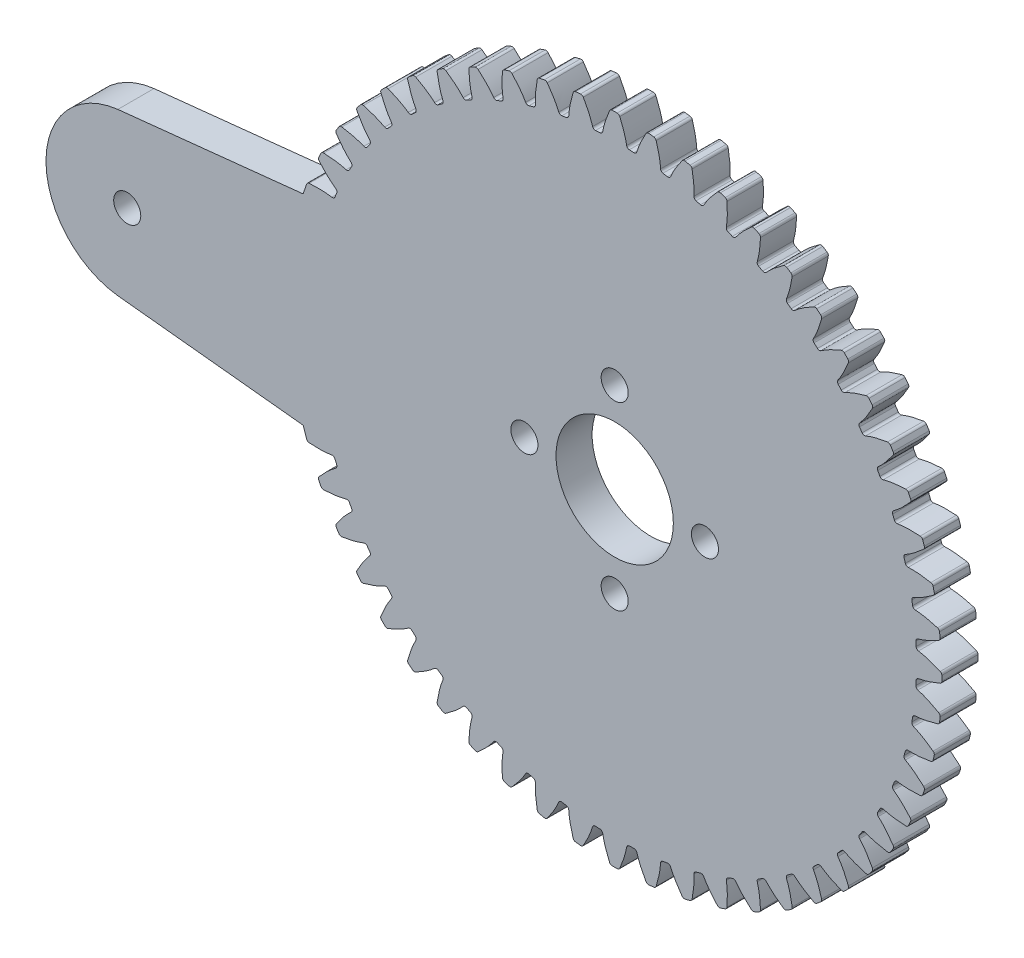
from build123d import *

# Parameters (mm, degrees)
SKETCH_1_R          = 0.925
SKETCH_1_R_2        = 6.5
SKETCH_1_R_3        = 1.5
EXTRUDE_1_DEPTH     = 4
SKETCH_2_R          = 1.5
CUT_EXTRUDE_1_DEPTH = 73.79417917


with BuildPart() as part:
    # 草图1 → 凸台-拉伸1 (new body)
    with BuildSketch(Plane.XY):
        with BuildLine():
            Line((-34.50942405, 11.097844463), (-55.040148969, 8.939691836))
            ThreePointArc((-55.040148969, 8.939691836), (-60.688303502, 6.022175376), (-62.999444444, 0.099998457))
            Line((-62.999444444, 0.099998457), (-62.999444444, -0.099998457))
            ThreePointArc((-62.999444444, -0.099998457), (-60.688303429, -6.022175457), (-55.040148753, -8.939691861))
            Line((-55.040148753, -8.939691861), (-34.50942405, -11.097844464))
            ThreePointArc((-34.50942405, -11.097844464), (-34.320285102, -11.669641406), (-34.121672605, -12.238217135))
            ThreePointArc((-34.121672605, -12.238217135), (-34.014786782, -12.382890198), (-33.845856953, -12.444676824))
            add(Edge.make_bspline(
                [(-33.845856953, -12.444676824), (-33.491111813, -12.465528285), (-32.807050741, -12.49985801), (-31.964846502, -12.456104517), (-31.482465707, -12.393674502), (-31.327681969, -12.36898156)],
                knots=[0.205793923, 0.205793923, 0.205793923, 0.205793923, 1.271237168, 2.259978144, 2.730069625, 2.730069625, 2.730069625, 2.730069625], degree=3))
            ThreePointArc((-31.327681969, -12.36898156), (-31.124871156, -12.405422055), (-30.988835509, -12.560194268))
            ThreePointArc((-30.988835509, -12.560194268), (-30.940753286, -12.678177799), (-30.892221868, -12.79597727))
            ThreePointArc((-30.892221868, -12.79597727), (-30.843241959, -12.913590969), (-30.79381427, -13.031017189))
            ThreePointArc((-30.79381427, -13.031017189), (-30.780565517, -13.2366494), (-30.898207097, -13.405825622))
            add(Edge.make_bspline(
                [(-32.732350338, -15.132919594), (-32.496251854, -14.867332691), (-32.036822413, -14.359353687), (-31.410355692, -13.79476375), (-31.025116275, -13.497813706), (-30.898207097, -13.405825622)],
                knots=[0.205793923, 0.205793923, 0.205793923, 0.205793923, 1.271237168, 2.259978144, 2.730069625, 2.730069625, 2.730069625, 2.730069625], degree=3))
            ThreePointArc((-32.732350338, -15.132919594), (-32.808112023, -15.296060764), (-32.78139241, -15.473939759))
            ThreePointArc((-32.78139241, -15.473939759), (-32.660121461, -15.728285543), (-32.53687712, -15.981680991))
            ThreePointArc((-32.53687712, -15.981680991), (-32.414465128, -16.113476965), (-32.239679587, -16.15596095))
            add(Edge.make_bspline(
                [(-32.239679587, -16.15596095), (-31.884830388, -16.136962448), (-31.201226839, -16.094485775), (-30.36921704, -15.956710438), (-29.896859298, -15.840663458), (-29.74581354, -15.798795499)],
                knots=[0.205793923, 0.205793923, 0.205793923, 0.205793923, 1.271237168, 2.259978144, 2.730069625, 2.730069625, 2.730069625, 2.730069625], degree=3))
            ThreePointArc((-29.74581354, -15.798795499), (-29.540197918, -15.812299258), (-29.387688644, -15.950867136))
            ThreePointArc((-29.387688644, -15.950867136), (-29.326698789, -16.06272531), (-29.26528317, -16.174350288))
            ThreePointArc((-29.26528317, -16.174350288), (-29.20344268, -16.285740446), (-29.141178216, -16.39689417))
            ThreePointArc((-29.141178216, -16.39689417), (-29.104989266, -16.599750019), (-29.202949413, -16.781034174))
            add(Edge.make_bspline(
                [(-30.832186775, -18.702627429), (-30.627309127, -18.412275838), (-30.227644085, -17.856051122), (-29.668330472, -17.224869191), (-29.318761215, -16.886653176), (-29.202949413, -16.781034174)],
                knots=[0.205793923, 0.205793923, 0.205793923, 0.205793923, 1.271237168, 2.259978144, 2.730069625, 2.730069625, 2.730069625, 2.730069625], degree=3))
            ThreePointArc((-30.832186775, -18.702627429), (-30.889206071, -18.87322542), (-30.842738337, -19.046994301))
            ThreePointArc((-30.842738337, -19.046994301), (-30.693752222, -19.286162774), (-30.542911526, -19.524165936))
            ThreePointArc((-30.542911526, -19.524165936), (-30.406512768, -19.64142741), (-30.228069545, -19.664074493))
            add(Edge.make_bspline(
                [(-30.228069545, -19.664074493), (-29.877578721, -19.605464945), (-29.203029405, -19.486716044), (-28.391677053, -19.256651468), (-27.935282537, -19.088446879), (-27.789874247, -19.029930418)],
                knots=[0.205793923, 0.205793923, 0.205793923, 0.205793923, 1.271237168, 2.259978144, 2.730069625, 2.730069625, 2.730069625, 2.730069625], degree=3))
            ThreePointArc((-27.789874247, -19.029930418), (-27.584039552, -19.020327623), (-27.416974544, -19.140948594))
            ThreePointArc((-27.416974544, -19.140948594), (-27.343844038, -19.245274731), (-27.270316556, -19.349321466))
            ThreePointArc((-27.270316556, -19.349321466), (-27.196393165, -19.453087289), (-27.122074938, -19.556570693))
            ThreePointArc((-27.122074938, -19.556570693), (-27.063400888, -19.75409915), (-27.140447697, -19.945211485))
            add(Edge.make_bspline(
                [(-28.544290574, -22.037138873), (-28.373210218, -21.725673933), (-28.038335594, -21.128198354), (-27.553208783, -20.438361907), (-27.243705723, -20.063133184), (-27.140447697, -19.945211485)],
                knots=[0.205793923, 0.205793923, 0.205793923, 0.205793923, 1.271237168, 2.259978144, 2.730069625, 2.730069625, 2.730069625, 2.730069625], degree=3))
            ThreePointArc((-28.544290574, -22.037138873), (-28.58185043, -22.213048314), (-28.516218934, -22.380521838))
            ThreePointArc((-28.516218934, -22.380521838), (-28.341391239, -22.601505317), (-28.164851099, -22.821123166))
            ThreePointArc((-28.164851099, -22.821123166), (-28.016180868, -22.922375509), (-27.83632399, -22.92490089))
            add(Edge.make_bspline(
                [(-27.83632399, -22.92490089), (-27.494599165, -22.827417345), (-26.837586933, -22.633889551), (-26.057095254, -22.314428932), (-25.622403389, -22.096182006), (-25.484461161, -22.021752921)],
                knots=[0.205793923, 0.205793923, 0.205793923, 0.205793923, 1.271237168, 2.259978144, 2.730069625, 2.730069625, 2.730069625, 2.730069625], degree=3))
            ThreePointArc((-25.484461161, -22.021752921), (-25.280995883, -21.989164332), (-25.101476081, -22.090321518))
            ThreePointArc((-25.101476081, -22.090321518), (-25.017124583, -22.185803655), (-24.932409888, -22.2809637))
            ThreePointArc((-24.932409888, -22.2809637), (-24.847333226, -22.375800272), (-24.761895832, -22.470311993))
            ThreePointArc((-24.761895832, -22.470311993), (-24.681474542, -22.660029023), (-24.736639104, -22.858566189))
            add(Edge.make_bspline(
                [(-25.897433358, -25.094520509), (-25.762301727, -24.765859073), (-25.496428765, -24.134646233), (-25.091589506, -23.394830363), (-24.826044823, -22.987307652), (-24.736639104, -22.858566189)],
                knots=[0.205793923, 0.205793923, 0.205793923, 0.205793923, 1.271237168, 2.259978144, 2.730069625, 2.730069625, 2.730069625, 2.730069625], degree=3))
            ThreePointArc((-25.897433358, -25.094520509), (-25.915061437, -25.273529238), (-25.831091532, -25.432601327))
            ThreePointArc((-25.831091532, -25.432601327), (-25.632620818, -25.632620818), (-25.432601327, -25.831091532))
            ThreePointArc((-25.432601327, -25.831091532), (-25.273529238, -25.915061437), (-25.094520509, -25.897433358))
            add(Edge.make_bspline(
                [(-25.094520509, -25.897433358), (-24.765859073, -25.762301727), (-24.134646233, -25.496428765), (-23.394830363, -25.091589506), (-22.987307652, -24.826044823), (-22.858566189, -24.736639104)],
                knots=[0.205793923, 0.205793923, 0.205793923, 0.205793923, 1.271237168, 2.259978144, 2.730069625, 2.730069625, 2.730069625, 2.730069625], degree=3))
            ThreePointArc((-22.858566189, -24.736639104), (-22.660029023, -24.681474542), (-22.470311993, -24.761895832))
            ThreePointArc((-22.470311993, -24.761895832), (-22.375800272, -24.847333226), (-22.2809637, -24.932409888))
            ThreePointArc((-22.2809637, -24.932409888), (-22.185803655, -25.017124583), (-22.090321518, -25.101476081))
            ThreePointArc((-22.090321518, -25.101476081), (-21.989164332, -25.280995883), (-22.021752921, -25.484461161))
            add(Edge.make_bspline(
                [(-22.92490089, -27.83632399), (-22.827417345, -27.494599165), (-22.633889551, -26.837586933), (-22.314428932, -26.057095254), (-22.096182006, -25.622403389), (-22.021752921, -25.484461161)],
                knots=[0.205793923, 0.205793923, 0.205793923, 0.205793923, 1.271237168, 2.259978144, 2.730069625, 2.730069625, 2.730069625, 2.730069625], degree=3))
            ThreePointArc((-22.92490089, -27.83632399), (-22.922375509, -28.016180868), (-22.821123166, -28.164851099))
            ThreePointArc((-22.821123166, -28.164851099), (-22.601505317, -28.341391239), (-22.380521838, -28.516218933))
            ThreePointArc((-22.380521838, -28.516218933), (-22.213048314, -28.58185043), (-22.037138873, -28.544290574))
            add(Edge.make_bspline(
                [(-22.037138873, -28.544290574), (-21.725673933, -28.373210218), (-21.128198354, -28.038335594), (-20.438361907, -27.553208783), (-20.063133184, -27.243705722), (-19.945211485, -27.140447697)],
                knots=[0.205793923, 0.205793923, 0.205793923, 0.205793923, 1.271237168, 2.259978144, 2.730069625, 2.730069625, 2.730069625, 2.730069625], degree=3))
            ThreePointArc((-19.945211485, -27.140447697), (-19.75409915, -27.063400888), (-19.556570693, -27.122074938))
            ThreePointArc((-19.556570693, -27.122074938), (-19.453087289, -27.196393165), (-19.349321466, -27.270316556))
            ThreePointArc((-19.349321466, -27.270316556), (-19.245274731, -27.343844038), (-19.140948594, -27.416974544))
            ThreePointArc((-19.140948594, -27.416974544), (-19.020327623, -27.584039551), (-19.029930418, -27.789874247))
            add(Edge.make_bspline(
                [(-19.664074493, -30.228069545), (-19.605464945, -29.87757872), (-19.486716044, -29.203029405), (-19.256651468, -28.391677053), (-19.088446879, -27.935282537), (-19.029930418, -27.789874247)],
                knots=[0.205793923, 0.205793923, 0.205793923, 0.205793923, 1.271237168, 2.259978144, 2.730069625, 2.730069625, 2.730069625, 2.730069625], degree=3))
            ThreePointArc((-19.664074493, -30.228069545), (-19.64142741, -30.406512768), (-19.524165936, -30.542911526))
            ThreePointArc((-19.524165936, -30.542911526), (-19.286162774, -30.693752222), (-19.0469943, -30.842738337))
            ThreePointArc((-19.0469943, -30.842738337), (-18.873225419, -30.889206071), (-18.702627429, -30.832186775))
            add(Edge.make_bspline(
                [(-18.702627429, -30.832186775), (-18.412275838, -30.627309127), (-17.856051122, -30.227644085), (-17.22486919, -29.668330472), (-16.886653176, -29.318761215), (-16.781034174, -29.202949413)],
                knots=[0.205793923, 0.205793923, 0.205793923, 0.205793923, 1.271237168, 2.259978144, 2.730069625, 2.730069625, 2.730069625, 2.730069625], degree=3))
            ThreePointArc((-16.781034174, -29.202949413), (-16.599750019, -29.104989266), (-16.39689417, -29.141178216))
            ThreePointArc((-16.39689417, -29.141178216), (-16.285740446, -29.20344268), (-16.174350287, -29.26528317))
            ThreePointArc((-16.174350287, -29.26528317), (-16.06272531, -29.326698789), (-15.950867136, -29.387688644))
            ThreePointArc((-15.950867136, -29.387688644), (-15.812299258, -29.540197918), (-15.798795499, -29.74581354))
            add(Edge.make_bspline(
                [(-16.15596095, -32.239679587), (-16.136962448, -31.884830388), (-16.094485775, -31.201226838), (-15.956710438, -30.36921704), (-15.840663458, -29.896859298), (-15.798795499, -29.74581354)],
                knots=[0.205793923, 0.205793923, 0.205793923, 0.205793923, 1.271237168, 2.259978144, 2.730069625, 2.730069625, 2.730069625, 2.730069625], degree=3))
            ThreePointArc((-16.15596095, -32.239679587), (-16.113476965, -32.414465128), (-15.981680991, -32.536877119))
            ThreePointArc((-15.981680991, -32.536877119), (-15.728285543, -32.660121461), (-15.473939759, -32.78139241))
            ThreePointArc((-15.473939759, -32.78139241), (-15.296060764, -32.808112023), (-15.132919594, -32.732350338))
            add(Edge.make_bspline(
                [(-15.132919594, -32.732350338), (-14.867332691, -32.496251854), (-14.359353687, -32.036822412), (-13.79476375, -31.410355692), (-13.497813705, -31.025116274), (-13.405825622, -30.898207096)],
                knots=[0.205793923, 0.205793923, 0.205793923, 0.205793923, 1.271237168, 2.259978144, 2.730069625, 2.730069625, 2.730069625, 2.730069625], degree=3))
            ThreePointArc((-13.405825622, -30.898207096), (-13.236649399, -30.780565517), (-13.031017189, -30.793814269))
            ThreePointArc((-13.031017189, -30.793814269), (-12.913590969, -30.843241959), (-12.79597727, -30.892221868))
            ThreePointArc((-12.79597727, -30.892221868), (-12.678177799, -30.940753286), (-12.560194268, -30.988835509))
            ThreePointArc((-12.560194268, -30.988835509), (-12.405422055, -31.124871156), (-12.36898156, -31.327681969))
            add(Edge.make_bspline(
                [(-12.444676824, -33.845856952), (-12.465528285, -33.491111813), (-12.49985801, -32.807050741), (-12.456104517, -31.964846502), (-12.393674502, -31.482465707), (-12.36898156, -31.327681969)],
                knots=[0.205793923, 0.205793923, 0.205793923, 0.205793923, 1.271237168, 2.259978144, 2.730069625, 2.730069625, 2.730069625, 2.730069625], degree=3))
            ThreePointArc((-12.444676824, -33.845856952), (-12.382890198, -34.014786781), (-12.238217135, -34.121672605))
            ThreePointArc((-12.238217135, -34.121672605), (-11.972615996, -34.215770723), (-11.706291446, -34.307801453))
            ThreePointArc((-11.706291446, -34.307801453), (-11.52653927, -34.314436931), (-11.372906515, -34.220885603))
            add(Edge.make_bspline(
                [(-11.372906515, -34.220885603), (-11.13542421, -33.956535359), (-10.682079047, -33.44311911), (-10.191181152, -32.757377465), (-9.939231396, -32.341312495), (-9.862031034, -32.204901898)],
                knots=[0.205793923, 0.205793923, 0.205793923, 0.205793923, 1.271237168, 2.259978144, 2.730069625, 2.730069625, 2.730069625, 2.730069625], degree=3))
            ThreePointArc((-9.862031034, -32.204901898), (-9.707090234, -32.069058297), (-9.501267606, -32.059200241))
            ThreePointArc((-9.501267606, -32.059200241), (-9.379045592, -32.095169574), (-9.256687413, -32.130672952))
            ThreePointArc((-9.256687413, -32.130672952), (-9.134194847, -32.165709859), (-9.01156967, -32.200279786))
            ThreePointArc((-9.01156967, -32.200279786), (-8.842539472, -32.31813108), (-8.783620501, -32.51558662))
            add(Edge.make_bspline(
                [(-8.576893666, -35.026403029), (-8.637332871, -34.676223075), (-8.748037278, -34.000306945), (-8.798855854, -33.158499473), (-8.790827899, -32.672161843), (-8.783620501, -32.51558662)],
                knots=[0.205793923, 0.205793923, 0.205793923, 0.205793923, 1.271237168, 2.259978144, 2.730069625, 2.730069625, 2.730069625, 2.730069625], degree=3))
            ThreePointArc((-8.576893666, -35.026403029), (-8.496581401, -35.187352755), (-8.340850597, -35.277368259))
            ThreePointArc((-8.340850597, -35.277368259), (-8.066383856, -35.341136816), (-7.791429727, -35.402769987))
            ThreePointArc((-7.791429727, -35.402769987), (-7.612064857, -35.389237884), (-7.469872537, -35.279073377))
            add(Edge.make_bspline(
                [(-7.469872537, -35.279073377), (-7.263481308, -34.989795729), (-6.870471066, -34.428849181), (-6.459438537, -33.692456209), (-6.255657485, -33.250797947), (-6.194215684, -33.106601372)],
                knots=[0.205793923, 0.205793923, 0.205793923, 0.205793923, 1.271237168, 2.259978144, 2.730069625, 2.730069625, 2.730069625, 2.730069625], degree=3))
            ThreePointArc((-6.194215684, -33.106601372), (-6.055458777, -32.954264062), (-5.85203407, -32.921423169))
            ThreePointArc((-5.85203407, -32.921423169), (-5.726553275, -32.943481811), (-5.600989342, -32.965062181))
            ThreePointArc((-5.600989342, -32.965062181), (-5.475344094, -32.986163967), (-5.349619355, -33.006786862))
            ThreePointArc((-5.349619355, -33.006786862), (-5.168456825, -33.104971755), (-5.087800318, -33.294588904))
            add(Edge.make_bspline(
                [(-4.601251094, -35.766471764), (-4.700517985, -35.425260713), (-4.886204901, -34.765989562), (-5.030956473, -33.935165074), (-5.077431534, -33.450986587), (-5.087800318, -33.294588904)],
                knots=[0.205793923, 0.205793923, 0.205793923, 0.205793923, 1.271237168, 2.259978144, 2.730069625, 2.730069625, 2.730069625, 2.730069625], degree=3))
            ThreePointArc((-4.601251094, -35.766471764), (-4.503423164, -35.917417352), (-4.338593024, -35.989430539))
            ThreePointArc((-4.338593024, -35.989430539), (-4.058712259, -36.022067608), (-3.778586258, -36.052528148))
            ThreePointArc((-3.778586258, -36.052528148), (-3.601864311, -36.018998638), (-3.472900579, -35.893606334))
            add(Edge.make_bspline(
                [(-3.472900579, -35.893606334), (-3.300195914, -35.583039117), (-2.972462924, -34.981616497), (-2.646464736, -34.203832768), (-2.493415052, -33.742135321), (-2.448504477, -33.591966126)],
                knots=[0.205793923, 0.205793923, 0.205793923, 0.205793923, 1.271237168, 2.259978144, 2.730069625, 2.730069625, 2.730069625, 2.730069625], degree=3))
            ThreePointArc((-2.448504477, -33.591966126), (-2.327676412, -33.425050836), (-2.129207811, -33.369640099))
            ThreePointArc((-2.129207811, -33.369640099), (-2.002046228, -33.377510649), (-1.874855579, -33.384896627))
            ThreePointArc((-1.874855579, -33.384896627), (-1.747637712, -33.391797925), (-1.620394472, -33.398214443))
            ThreePointArc((-1.620394472, -33.398214443), (-1.429377834, -33.475498202), (-1.327998093, -33.654892414))
            add(Edge.make_bspline(
                [(-0.56774512, -36.056756365), (-0.704591358, -35.728805142), (-0.962925663, -35.094469689), (-1.199789896, -34.285076284), (-1.300183522, -33.809145767), (-1.327998093, -33.654892414)],
                knots=[0.205793923, 0.205793923, 0.205793923, 0.205793923, 1.271237168, 2.259978144, 2.730069625, 2.730069625, 2.730069625, 2.730069625], degree=3))
            ThreePointArc((-0.56774512, -36.056756365), (-0.453631768, -36.195799586), (-0.281775126, -36.248904849))
            ThreePointArc((-0.281775126, -36.248904849), (0, -36.25), (0.281775126, -36.248904849))
            ThreePointArc((0.281775126, -36.248904849), (0.453631768, -36.195799586), (0.56774512, -36.056756365))
            add(Edge.make_bspline(
                [(0.56774512, -36.056756365), (0.704591358, -35.728805142), (0.962925663, -35.094469689), (1.199789896, -34.285076284), (1.300183522, -33.809145766), (1.327998093, -33.654892414)],
                knots=[0.205793923, 0.205793923, 0.205793923, 0.205793923, 1.271237168, 2.259978144, 2.730069625, 2.730069625, 2.730069625, 2.730069625], degree=3))
            ThreePointArc((1.327998093, -33.654892414), (1.429377834, -33.475498202), (1.620394472, -33.398214443))
            ThreePointArc((1.620394472, -33.398214443), (1.747637712, -33.391797925), (1.874855579, -33.384896627))
            ThreePointArc((1.874855579, -33.384896627), (2.002046228, -33.377510649), (2.129207811, -33.369640099))
            ThreePointArc((2.129207811, -33.369640099), (2.327676412, -33.425050836), (2.448504477, -33.591966126))
            add(Edge.make_bspline(
                [(3.472900579, -35.893606334), (3.300195914, -35.583039118), (2.972462925, -34.981616497), (2.646464736, -34.203832768), (2.493415052, -33.742135322), (2.448504477, -33.591966126)],
                knots=[0.205793923, 0.205793923, 0.205793923, 0.205793923, 1.271237168, 2.259978144, 2.730069625, 2.730069625, 2.730069625, 2.730069625], degree=3))
            ThreePointArc((3.472900579, -35.893606334), (3.601864311, -36.018998639), (3.778586258, -36.052528148))
            ThreePointArc((3.778586258, -36.052528148), (4.058712259, -36.022067609), (4.338593024, -35.98943054))
            ThreePointArc((4.338593024, -35.98943054), (4.503423164, -35.917417352), (4.601251094, -35.766471764))
            add(Edge.make_bspline(
                [(4.601251094, -35.766471764), (4.700517985, -35.425260713), (4.886204901, -34.765989563), (5.030956473, -33.935165074), (5.077431535, -33.450986588), (5.087800318, -33.294588904)],
                knots=[0.205793923, 0.205793923, 0.205793923, 0.205793923, 1.271237168, 2.259978144, 2.730069625, 2.730069625, 2.730069625, 2.730069625], degree=3))
            ThreePointArc((5.087800318, -33.294588904), (5.168456825, -33.104971755), (5.349619355, -33.006786863))
            ThreePointArc((5.349619355, -33.006786863), (5.475344094, -32.986163968), (5.600989342, -32.965062182))
            ThreePointArc((5.600989342, -32.965062182), (5.726553275, -32.943481811), (5.852034071, -32.921423169))
            ThreePointArc((5.852034071, -32.921423169), (6.055458777, -32.954264062), (6.194215684, -33.106601373))
            add(Edge.make_bspline(
                [(7.469872538, -35.279073377), (7.263481308, -34.98979573), (6.870471066, -34.428849181), (6.459438538, -33.692456209), (6.255657485, -33.250797947), (6.194215684, -33.106601373)],
                knots=[0.205793923, 0.205793923, 0.205793923, 0.205793923, 1.271237168, 2.259978144, 2.730069625, 2.730069625, 2.730069625, 2.730069625], degree=3))
            ThreePointArc((7.469872538, -35.279073377), (7.612064857, -35.389237885), (7.791429727, -35.402769988))
            ThreePointArc((7.791429727, -35.402769988), (8.066383856, -35.341136817), (8.340850597, -35.277368259))
            ThreePointArc((8.340850597, -35.277368259), (8.496581401, -35.187352755), (8.576893666, -35.026403029))
            add(Edge.make_bspline(
                [(8.576893666, -35.026403029), (8.637332871, -34.676223076), (8.748037278, -34.000306946), (8.798855854, -33.158499473), (8.790827899, -32.672161843), (8.783620501, -32.515586621)],
                knots=[0.205793923, 0.205793923, 0.205793923, 0.205793923, 1.271237168, 2.259978144, 2.730069625, 2.730069625, 2.730069625, 2.730069625], degree=3))
            ThreePointArc((8.783620501, -32.515586621), (8.842539472, -32.318131081), (9.01156967, -32.200279786))
            ThreePointArc((9.01156967, -32.200279786), (9.134194847, -32.165709859), (9.256687413, -32.130672953))
            ThreePointArc((9.256687413, -32.130672953), (9.379045592, -32.095169575), (9.501267606, -32.059200241))
            ThreePointArc((9.501267606, -32.059200241), (9.707090234, -32.069058297), (9.862031034, -32.204901898))
            add(Edge.make_bspline(
                [(11.372906515, -34.220885604), (11.13542421, -33.956535359), (10.682079047, -33.44311911), (10.191181152, -32.757377465), (9.939231396, -32.341312495), (9.862031034, -32.204901898)],
                knots=[0.205793923, 0.205793923, 0.205793923, 0.205793923, 1.271237168, 2.259978144, 2.730069625, 2.730069625, 2.730069625, 2.730069625], degree=3))
            ThreePointArc((11.372906515, -34.220885604), (11.52653927, -34.314436931), (11.706291446, -34.307801454))
            ThreePointArc((11.706291446, -34.307801454), (11.972615996, -34.215770724), (12.238217135, -34.121672605))
            ThreePointArc((12.238217135, -34.121672605), (12.382890198, -34.014786782), (12.444676824, -33.845856953))
            add(Edge.make_bspline(
                [(12.444676824, -33.845856953), (12.465528285, -33.491111813), (12.49985801, -32.807050741), (12.456104517, -31.964846502), (12.393674502, -31.482465707), (12.36898156, -31.327681969)],
                knots=[0.205793923, 0.205793923, 0.205793923, 0.205793923, 1.271237168, 2.259978144, 2.730069625, 2.730069625, 2.730069625, 2.730069625], degree=3))
            ThreePointArc((12.36898156, -31.327681969), (12.405422055, -31.124871156), (12.560194268, -30.988835509))
            ThreePointArc((12.560194268, -30.988835509), (12.678177799, -30.940753286), (12.79597727, -30.892221868))
            ThreePointArc((12.79597727, -30.892221868), (12.913590969, -30.843241959), (13.031017189, -30.79381427))
            ThreePointArc((13.031017189, -30.79381427), (13.2366494, -30.780565517), (13.405825622, -30.898207097))
            add(Edge.make_bspline(
                [(15.132919594, -32.732350338), (14.867332691, -32.496251854), (14.359353687, -32.036822413), (13.79476375, -31.410355692), (13.497813706, -31.025116275), (13.405825622, -30.898207097)],
                knots=[0.205793923, 0.205793923, 0.205793923, 0.205793923, 1.271237168, 2.259978144, 2.730069625, 2.730069625, 2.730069625, 2.730069625], degree=3))
            ThreePointArc((15.132919594, -32.732350338), (15.296060764, -32.808112023), (15.473939759, -32.78139241))
            ThreePointArc((15.473939759, -32.78139241), (15.728285543, -32.660121461), (15.981680991, -32.53687712))
            ThreePointArc((15.981680991, -32.53687712), (16.113476965, -32.414465128), (16.15596095, -32.239679587))
            add(Edge.make_bspline(
                [(16.15596095, -32.239679587), (16.136962448, -31.884830388), (16.094485775, -31.201226839), (15.956710439, -30.36921704), (15.840663458, -29.896859298), (15.798795499, -29.74581354)],
                knots=[0.205793923, 0.205793923, 0.205793923, 0.205793923, 1.271237168, 2.259978144, 2.730069625, 2.730069625, 2.730069625, 2.730069625], degree=3))
            ThreePointArc((15.798795499, -29.74581354), (15.812299258, -29.540197918), (15.950867136, -29.387688644))
            ThreePointArc((15.950867136, -29.387688644), (16.062725311, -29.326698789), (16.174350288, -29.26528317))
            ThreePointArc((16.174350288, -29.26528317), (16.285740447, -29.20344268), (16.39689417, -29.141178216))
            ThreePointArc((16.39689417, -29.141178216), (16.599750019, -29.104989266), (16.781034174, -29.202949413))
            add(Edge.make_bspline(
                [(18.702627429, -30.832186775), (18.412275838, -30.627309127), (17.856051122, -30.227644085), (17.224869191, -29.668330472), (16.886653176, -29.318761215), (16.781034174, -29.202949413)],
                knots=[0.205793923, 0.205793923, 0.205793923, 0.205793923, 1.271237168, 2.259978144, 2.730069625, 2.730069625, 2.730069625, 2.730069625], degree=3))
            ThreePointArc((18.702627429, -30.832186775), (18.87322542, -30.889206071), (19.046994301, -30.842738337))
            ThreePointArc((19.046994301, -30.842738337), (19.286162774, -30.693752222), (19.524165936, -30.542911526))
            ThreePointArc((19.524165936, -30.542911526), (19.64142741, -30.406512768), (19.664074493, -30.228069545))
            add(Edge.make_bspline(
                [(19.664074493, -30.228069545), (19.605464945, -29.877578721), (19.486716044, -29.203029405), (19.256651468, -28.391677053), (19.088446879, -27.935282537), (19.029930418, -27.789874247)],
                knots=[0.205793923, 0.205793923, 0.205793923, 0.205793923, 1.271237168, 2.259978144, 2.730069625, 2.730069625, 2.730069625, 2.730069625], degree=3))
            ThreePointArc((19.029930418, -27.789874247), (19.020327623, -27.584039552), (19.140948594, -27.416974544))
            ThreePointArc((19.140948594, -27.416974544), (19.245274731, -27.343844038), (19.349321466, -27.270316556))
            ThreePointArc((19.349321466, -27.270316556), (19.453087289, -27.196393165), (19.556570693, -27.122074939))
            ThreePointArc((19.556570693, -27.122074939), (19.75409915, -27.063400888), (19.945211485, -27.140447697))
            add(Edge.make_bspline(
                [(22.037138873, -28.544290574), (21.725673933, -28.373210218), (21.128198354, -28.038335594), (20.438361907, -27.553208783), (20.063133184, -27.243705723), (19.945211485, -27.140447697)],
                knots=[0.205793923, 0.205793923, 0.205793923, 0.205793923, 1.271237168, 2.259978144, 2.730069625, 2.730069625, 2.730069625, 2.730069625], degree=3))
            ThreePointArc((22.037138873, -28.544290574), (22.213048314, -28.58185043), (22.380521838, -28.516218934))
            ThreePointArc((22.380521838, -28.516218934), (22.601505317, -28.341391239), (22.821123167, -28.164851099))
            ThreePointArc((22.821123167, -28.164851099), (22.922375509, -28.016180868), (22.92490089, -27.83632399))
            add(Edge.make_bspline(
                [(22.92490089, -27.83632399), (22.827417345, -27.494599165), (22.633889551, -26.837586933), (22.314428932, -26.057095254), (22.096182006, -25.622403389), (22.021752921, -25.484461161)],
                knots=[0.205793923, 0.205793923, 0.205793923, 0.205793923, 1.271237168, 2.259978144, 2.730069625, 2.730069625, 2.730069625, 2.730069625], degree=3))
            ThreePointArc((22.021752921, -25.484461161), (21.989164332, -25.280995883), (22.090321518, -25.101476082))
            ThreePointArc((22.090321518, -25.101476082), (22.185803655, -25.017124583), (22.2809637, -24.932409888))
            ThreePointArc((22.2809637, -24.932409888), (22.375800272, -24.847333226), (22.470311993, -24.761895832))
            ThreePointArc((22.470311993, -24.761895832), (22.660029023, -24.681474542), (22.858566189, -24.736639104))
            add(Edge.make_bspline(
                [(25.094520509, -25.897433358), (24.765859073, -25.762301727), (24.134646233, -25.496428765), (23.394830363, -25.091589506), (22.987307652, -24.826044823), (22.858566189, -24.736639104)],
                knots=[0.205793923, 0.205793923, 0.205793923, 0.205793923, 1.271237168, 2.259978144, 2.730069625, 2.730069625, 2.730069625, 2.730069625], degree=3))
            ThreePointArc((25.094520509, -25.897433358), (25.273529239, -25.915061437), (25.432601327, -25.831091532))
            ThreePointArc((25.432601327, -25.831091532), (25.632620818, -25.632620818), (25.831091532, -25.432601327))
            ThreePointArc((25.831091532, -25.432601327), (25.915061437, -25.273529239), (25.897433358, -25.094520509))
            add(Edge.make_bspline(
                [(25.897433358, -25.094520509), (25.762301727, -24.765859073), (25.496428765, -24.134646234), (25.091589506, -23.394830363), (24.826044823, -22.987307652), (24.736639104, -22.858566189)],
                knots=[0.205793923, 0.205793923, 0.205793923, 0.205793923, 1.271237168, 2.259978144, 2.730069625, 2.730069625, 2.730069625, 2.730069625], degree=3))
            ThreePointArc((24.736639104, -22.858566189), (24.681474542, -22.660029023), (24.761895832, -22.470311993))
            ThreePointArc((24.761895832, -22.470311993), (24.847333226, -22.375800272), (24.932409888, -22.2809637))
            ThreePointArc((24.932409888, -22.2809637), (25.017124583, -22.185803655), (25.101476082, -22.090321518))
            ThreePointArc((25.101476082, -22.090321518), (25.280995883, -21.989164332), (25.484461161, -22.021752921))
            add(Edge.make_bspline(
                [(27.83632399, -22.92490089), (27.494599165, -22.827417345), (26.837586933, -22.633889551), (26.057095254, -22.314428932), (25.622403389, -22.096182006), (25.484461161, -22.021752921)],
                knots=[0.205793923, 0.205793923, 0.205793923, 0.205793923, 1.271237168, 2.259978144, 2.730069625, 2.730069625, 2.730069625, 2.730069625], degree=3))
            ThreePointArc((27.83632399, -22.92490089), (28.016180868, -22.922375509), (28.164851099, -22.821123167))
            ThreePointArc((28.164851099, -22.821123167), (28.341391239, -22.601505317), (28.516218934, -22.380521838))
            ThreePointArc((28.516218934, -22.380521838), (28.58185043, -22.213048314), (28.544290574, -22.037138873))
            add(Edge.make_bspline(
                [(28.544290574, -22.037138873), (28.373210218, -21.725673933), (28.038335594, -21.128198354), (27.553208783, -20.438361907), (27.243705723, -20.063133184), (27.140447697, -19.945211485)],
                knots=[0.205793923, 0.205793923, 0.205793923, 0.205793923, 1.271237168, 2.259978144, 2.730069625, 2.730069625, 2.730069625, 2.730069625], degree=3))
            ThreePointArc((27.140447697, -19.945211485), (27.063400888, -19.75409915), (27.122074939, -19.556570693))
            ThreePointArc((27.122074939, -19.556570693), (27.196393165, -19.453087289), (27.270316556, -19.349321466))
            ThreePointArc((27.270316556, -19.349321466), (27.343844038, -19.245274731), (27.416974544, -19.140948594))
            ThreePointArc((27.416974544, -19.140948594), (27.584039552, -19.020327623), (27.789874247, -19.029930418))
            add(Edge.make_bspline(
                [(30.228069545, -19.664074493), (29.877578721, -19.605464945), (29.203029405, -19.486716044), (28.391677053, -19.256651468), (27.935282537, -19.088446879), (27.789874247, -19.029930418)],
                knots=[0.205793923, 0.205793923, 0.205793923, 0.205793923, 1.271237168, 2.259978144, 2.730069625, 2.730069625, 2.730069625, 2.730069625], degree=3))
            ThreePointArc((30.228069545, -19.664074493), (30.406512768, -19.64142741), (30.542911526, -19.524165936))
            ThreePointArc((30.542911526, -19.524165936), (30.693752222, -19.286162774), (30.842738337, -19.046994301))
            ThreePointArc((30.842738337, -19.046994301), (30.889206071, -18.87322542), (30.832186775, -18.702627429))
            add(Edge.make_bspline(
                [(30.832186775, -18.702627429), (30.627309127, -18.412275838), (30.227644085, -17.856051122), (29.668330472, -17.224869191), (29.318761215, -16.886653176), (29.202949413, -16.781034174)],
                knots=[0.205793923, 0.205793923, 0.205793923, 0.205793923, 1.271237168, 2.259978144, 2.730069625, 2.730069625, 2.730069625, 2.730069625], degree=3))
            ThreePointArc((29.202949413, -16.781034174), (29.104989266, -16.599750019), (29.141178216, -16.39689417))
            ThreePointArc((29.141178216, -16.39689417), (29.20344268, -16.285740447), (29.26528317, -16.174350288))
            ThreePointArc((29.26528317, -16.174350288), (29.326698789, -16.062725311), (29.387688644, -15.950867136))
            ThreePointArc((29.387688644, -15.950867136), (29.540197918, -15.812299258), (29.74581354, -15.798795499))
            add(Edge.make_bspline(
                [(32.239679587, -16.15596095), (31.884830388, -16.136962448), (31.201226839, -16.094485775), (30.36921704, -15.956710438), (29.896859298, -15.840663458), (29.74581354, -15.798795499)],
                knots=[0.205793923, 0.205793923, 0.205793923, 0.205793923, 1.271237168, 2.259978144, 2.730069625, 2.730069625, 2.730069625, 2.730069625], degree=3))
            ThreePointArc((32.239679587, -16.15596095), (32.414465128, -16.113476965), (32.53687712, -15.981680991))
            ThreePointArc((32.53687712, -15.981680991), (32.660121461, -15.728285543), (32.78139241, -15.473939759))
            ThreePointArc((32.78139241, -15.473939759), (32.808112023, -15.296060764), (32.732350338, -15.132919594))
            add(Edge.make_bspline(
                [(32.732350338, -15.132919594), (32.496251854, -14.867332691), (32.036822413, -14.359353687), (31.410355692, -13.79476375), (31.025116275, -13.497813706), (30.898207097, -13.405825622)],
                knots=[0.205793923, 0.205793923, 0.205793923, 0.205793923, 1.271237168, 2.259978144, 2.730069625, 2.730069625, 2.730069625, 2.730069625], degree=3))
            ThreePointArc((30.898207097, -13.405825622), (30.780565517, -13.2366494), (30.793814269, -13.031017189))
            ThreePointArc((30.793814269, -13.031017189), (30.843241959, -12.913590969), (30.892221868, -12.79597727))
            ThreePointArc((30.892221868, -12.79597727), (30.940753286, -12.678177799), (30.988835509, -12.560194268))
            ThreePointArc((30.988835509, -12.560194268), (31.124871156, -12.405422055), (31.327681969, -12.36898156))
            add(Edge.make_bspline(
                [(33.845856952, -12.444676824), (33.491111813, -12.465528285), (32.807050741, -12.49985801), (31.964846502, -12.456104517), (31.482465707, -12.393674502), (31.327681969, -12.36898156)],
                knots=[0.205793923, 0.205793923, 0.205793923, 0.205793923, 1.271237168, 2.259978144, 2.730069625, 2.730069625, 2.730069625, 2.730069625], degree=3))
            ThreePointArc((33.845856952, -12.444676824), (34.014786782, -12.382890198), (34.121672605, -12.238217135))
            ThreePointArc((34.121672605, -12.238217135), (34.215770724, -11.972615996), (34.307801454, -11.706291446))
            ThreePointArc((34.307801454, -11.706291446), (34.314436931, -11.52653927), (34.220885604, -11.372906515))
            add(Edge.make_bspline(
                [(34.220885604, -11.372906515), (33.956535359, -11.13542421), (33.44311911, -10.682079047), (32.757377465, -10.191181152), (32.341312495, -9.939231396), (32.204901898, -9.862031034)],
                knots=[0.205793923, 0.205793923, 0.205793923, 0.205793923, 1.271237168, 2.259978144, 2.730069625, 2.730069625, 2.730069625, 2.730069625], degree=3))
            ThreePointArc((32.204901898, -9.862031034), (32.069058297, -9.707090234), (32.059200241, -9.501267606))
            ThreePointArc((32.059200241, -9.501267606), (32.095169575, -9.379045592), (32.130672953, -9.256687413))
            ThreePointArc((32.130672953, -9.256687413), (32.165709859, -9.134194847), (32.200279786, -9.01156967))
            ThreePointArc((32.200279786, -9.01156967), (32.318131081, -8.842539472), (32.515586621, -8.783620501))
            add(Edge.make_bspline(
                [(35.026403029, -8.576893666), (34.676223076, -8.637332871), (34.000306946, -8.748037278), (33.158499473, -8.798855854), (32.672161843, -8.790827899), (32.515586621, -8.783620501)],
                knots=[0.205793923, 0.205793923, 0.205793923, 0.205793923, 1.271237168, 2.259978144, 2.730069625, 2.730069625, 2.730069625, 2.730069625], degree=3))
            ThreePointArc((35.026403029, -8.576893666), (35.187352755, -8.496581401), (35.277368259, -8.340850597))
            ThreePointArc((35.277368259, -8.340850597), (35.341136817, -8.066383856), (35.402769988, -7.791429727))
            ThreePointArc((35.402769988, -7.791429727), (35.389237885, -7.612064857), (35.279073377, -7.469872538))
            add(Edge.make_bspline(
                [(35.279073377, -7.469872538), (34.98979573, -7.263481308), (34.428849181, -6.870471066), (33.692456209, -6.459438538), (33.250797947, -6.255657485), (33.106601373, -6.194215684)],
                knots=[0.205793923, 0.205793923, 0.205793923, 0.205793923, 1.271237168, 2.259978144, 2.730069625, 2.730069625, 2.730069625, 2.730069625], degree=3))
            ThreePointArc((33.106601373, -6.194215684), (32.954264062, -6.055458777), (32.921423169, -5.852034071))
            ThreePointArc((32.921423169, -5.852034071), (32.943481811, -5.726553275), (32.965062182, -5.600989342))
            ThreePointArc((32.965062182, -5.600989342), (32.986163968, -5.475344094), (33.006786863, -5.349619355))
            ThreePointArc((33.006786863, -5.349619355), (33.104971755, -5.168456825), (33.294588904, -5.087800318))
            add(Edge.make_bspline(
                [(35.766471764, -4.601251094), (35.425260713, -4.700517985), (34.765989563, -4.886204901), (33.935165074, -5.030956473), (33.450986588, -5.077431535), (33.294588904, -5.087800318)],
                knots=[0.205793923, 0.205793923, 0.205793923, 0.205793923, 1.271237168, 2.259978144, 2.730069625, 2.730069625, 2.730069625, 2.730069625], degree=3))
            ThreePointArc((35.766471764, -4.601251094), (35.917417352, -4.503423164), (35.98943054, -4.338593024))
            ThreePointArc((35.98943054, -4.338593024), (36.022067609, -4.058712259), (36.052528148, -3.778586258))
            ThreePointArc((36.052528148, -3.778586258), (36.018998639, -3.601864311), (35.893606334, -3.472900579))
            add(Edge.make_bspline(
                [(35.893606334, -3.472900579), (35.583039118, -3.300195914), (34.981616497, -2.972462925), (34.203832768, -2.646464736), (33.742135322, -2.493415052), (33.591966126, -2.448504477)],
                knots=[0.205793923, 0.205793923, 0.205793923, 0.205793923, 1.271237168, 2.259978144, 2.730069625, 2.730069625, 2.730069625, 2.730069625], degree=3))
            ThreePointArc((33.591966126, -2.448504477), (33.425050836, -2.327676412), (33.369640099, -2.129207811))
            ThreePointArc((33.369640099, -2.129207811), (33.377510649, -2.002046228), (33.384896627, -1.874855579))
            ThreePointArc((33.384896627, -1.874855579), (33.391797925, -1.747637712), (33.398214443, -1.620394472))
            ThreePointArc((33.398214443, -1.620394472), (33.475498202, -1.429377834), (33.654892415, -1.327998093))
            add(Edge.make_bspline(
                [(36.056756365, -0.56774512), (35.728805143, -0.704591358), (35.094469689, -0.962925663), (34.285076285, -1.199789896), (33.809145767, -1.300183522), (33.654892415, -1.327998093)],
                knots=[0.205793923, 0.205793923, 0.205793923, 0.205793923, 1.271237168, 2.259978144, 2.730069625, 2.730069625, 2.730069625, 2.730069625], degree=3))
            ThreePointArc((36.056756365, -0.56774512), (36.195799586, -0.453631768), (36.248904849, -0.281775126))
            ThreePointArc((36.248904849, -0.281775126), (36.25, 0), (36.248904849, 0.281775126))
            ThreePointArc((36.248904849, 0.281775126), (36.195799586, 0.453631768), (36.056756365, 0.56774512))
            add(Edge.make_bspline(
                [(36.056756365, 0.56774512), (35.728805143, 0.704591358), (35.094469689, 0.962925663), (34.285076285, 1.199789896), (33.809145767, 1.300183522), (33.654892415, 1.327998093)],
                knots=[0.205793923, 0.205793923, 0.205793923, 0.205793923, 1.271237168, 2.259978144, 2.730069625, 2.730069625, 2.730069625, 2.730069625], degree=3))
            ThreePointArc((33.654892415, 1.327998093), (33.475498202, 1.429377834), (33.398214443, 1.620394472))
            ThreePointArc((33.398214443, 1.620394472), (33.391797925, 1.747637712), (33.384896627, 1.874855579))
            ThreePointArc((33.384896627, 1.874855579), (33.377510649, 2.002046228), (33.369640099, 2.129207811))
            ThreePointArc((33.369640099, 2.129207811), (33.425050836, 2.327676412), (33.591966126, 2.448504477))
            add(Edge.make_bspline(
                [(35.893606334, 3.472900579), (35.583039118, 3.300195914), (34.981616497, 2.972462925), (34.203832768, 2.646464736), (33.742135322, 2.493415052), (33.591966126, 2.448504477)],
                knots=[0.205793923, 0.205793923, 0.205793923, 0.205793923, 1.271237168, 2.259978144, 2.730069625, 2.730069625, 2.730069625, 2.730069625], degree=3))
            ThreePointArc((35.893606334, 3.472900579), (36.018998639, 3.601864311), (36.052528148, 3.778586258))
            ThreePointArc((36.052528148, 3.778586258), (36.022067609, 4.058712259), (35.98943054, 4.338593024))
            ThreePointArc((35.98943054, 4.338593024), (35.917417352, 4.503423164), (35.766471764, 4.601251094))
            add(Edge.make_bspline(
                [(35.766471764, 4.601251094), (35.425260713, 4.700517985), (34.765989563, 4.886204901), (33.935165074, 5.030956473), (33.450986588, 5.077431535), (33.294588904, 5.087800318)],
                knots=[0.205793923, 0.205793923, 0.205793923, 0.205793923, 1.271237168, 2.259978144, 2.730069625, 2.730069625, 2.730069625, 2.730069625], degree=3))
            ThreePointArc((33.294588904, 5.087800318), (33.104971755, 5.168456825), (33.006786863, 5.349619355))
            ThreePointArc((33.006786863, 5.349619355), (32.986163968, 5.475344094), (32.965062182, 5.600989342))
            ThreePointArc((32.965062182, 5.600989342), (32.943481811, 5.726553275), (32.921423169, 5.852034071))
            ThreePointArc((32.921423169, 5.852034071), (32.954264062, 6.055458777), (33.106601373, 6.194215684))
            add(Edge.make_bspline(
                [(35.279073377, 7.469872538), (34.98979573, 7.263481308), (34.428849181, 6.870471066), (33.692456209, 6.459438538), (33.250797947, 6.255657485), (33.106601373, 6.194215684)],
                knots=[0.205793923, 0.205793923, 0.205793923, 0.205793923, 1.271237168, 2.259978144, 2.730069625, 2.730069625, 2.730069625, 2.730069625], degree=3))
            ThreePointArc((35.279073377, 7.469872538), (35.389237885, 7.612064857), (35.402769988, 7.791429727))
            ThreePointArc((35.402769988, 7.791429727), (35.341136817, 8.066383856), (35.277368259, 8.340850597))
            ThreePointArc((35.277368259, 8.340850597), (35.187352755, 8.496581401), (35.026403029, 8.576893666))
            add(Edge.make_bspline(
                [(35.026403029, 8.576893666), (34.676223076, 8.637332871), (34.000306946, 8.748037278), (33.158499473, 8.798855854), (32.672161843, 8.790827899), (32.515586621, 8.783620501)],
                knots=[0.205793923, 0.205793923, 0.205793923, 0.205793923, 1.271237168, 2.259978144, 2.730069625, 2.730069625, 2.730069625, 2.730069625], degree=3))
            ThreePointArc((32.515586621, 8.783620501), (32.318131081, 8.842539472), (32.200279786, 9.01156967))
            ThreePointArc((32.200279786, 9.01156967), (32.165709859, 9.134194847), (32.130672953, 9.256687413))
            ThreePointArc((32.130672953, 9.256687413), (32.095169575, 9.379045592), (32.059200241, 9.501267606))
            ThreePointArc((32.059200241, 9.501267606), (32.069058297, 9.707090234), (32.204901898, 9.862031034))
            add(Edge.make_bspline(
                [(34.220885604, 11.372906515), (33.956535359, 11.13542421), (33.44311911, 10.682079047), (32.757377465, 10.191181152), (32.341312495, 9.939231396), (32.204901898, 9.862031034)],
                knots=[0.205793923, 0.205793923, 0.205793923, 0.205793923, 1.271237168, 2.259978144, 2.730069625, 2.730069625, 2.730069625, 2.730069625], degree=3))
            ThreePointArc((34.220885604, 11.372906515), (34.314436931, 11.52653927), (34.307801454, 11.706291446))
            ThreePointArc((34.307801454, 11.706291446), (34.215770724, 11.972615996), (34.121672605, 12.238217135))
            ThreePointArc((34.121672605, 12.238217135), (34.014786782, 12.382890198), (33.845856953, 12.444676824))
            add(Edge.make_bspline(
                [(33.845856953, 12.444676824), (33.491111813, 12.465528285), (32.807050741, 12.49985801), (31.964846502, 12.456104517), (31.482465707, 12.393674502), (31.327681969, 12.36898156)],
                knots=[0.205793923, 0.205793923, 0.205793923, 0.205793923, 1.271237168, 2.259978144, 2.730069625, 2.730069625, 2.730069625, 2.730069625], degree=3))
            ThreePointArc((31.327681969, 12.36898156), (31.124871156, 12.405422055), (30.988835509, 12.560194268))
            ThreePointArc((30.988835509, 12.560194268), (30.940753286, 12.678177799), (30.892221868, 12.79597727))
            ThreePointArc((30.892221868, 12.79597727), (30.843241959, 12.913590969), (30.79381427, 13.031017189))
            ThreePointArc((30.79381427, 13.031017189), (30.780565517, 13.2366494), (30.898207097, 13.405825622))
            add(Edge.make_bspline(
                [(32.732350338, 15.132919594), (32.496251854, 14.867332691), (32.036822413, 14.359353687), (31.410355692, 13.79476375), (31.025116275, 13.497813706), (30.898207097, 13.405825622)],
                knots=[0.205793923, 0.205793923, 0.205793923, 0.205793923, 1.271237168, 2.259978144, 2.730069625, 2.730069625, 2.730069625, 2.730069625], degree=3))
            ThreePointArc((32.732350338, 15.132919594), (32.808112023, 15.296060764), (32.78139241, 15.473939759))
            ThreePointArc((32.78139241, 15.473939759), (32.660121461, 15.728285543), (32.53687712, 15.981680991))
            ThreePointArc((32.53687712, 15.981680991), (32.414465128, 16.113476965), (32.239679587, 16.15596095))
            add(Edge.make_bspline(
                [(32.239679587, 16.15596095), (31.884830388, 16.136962448), (31.201226839, 16.094485775), (30.36921704, 15.956710439), (29.896859298, 15.840663458), (29.74581354, 15.798795499)],
                knots=[0.205793923, 0.205793923, 0.205793923, 0.205793923, 1.271237168, 2.259978144, 2.730069625, 2.730069625, 2.730069625, 2.730069625], degree=3))
            ThreePointArc((29.74581354, 15.798795499), (29.540197918, 15.812299258), (29.387688644, 15.950867136))
            ThreePointArc((29.387688644, 15.950867136), (29.326698789, 16.06272531), (29.26528317, 16.174350288))
            ThreePointArc((29.26528317, 16.174350288), (29.20344268, 16.285740447), (29.141178216, 16.39689417))
            ThreePointArc((29.141178216, 16.39689417), (29.104989266, 16.599750019), (29.202949413, 16.781034174))
            add(Edge.make_bspline(
                [(30.832186775, 18.702627429), (30.627309127, 18.412275838), (30.227644085, 17.856051122), (29.668330472, 17.224869191), (29.318761215, 16.886653176), (29.202949413, 16.781034174)],
                knots=[0.205793923, 0.205793923, 0.205793923, 0.205793923, 1.271237168, 2.259978144, 2.730069625, 2.730069625, 2.730069625, 2.730069625], degree=3))
            ThreePointArc((30.832186775, 18.702627429), (30.889206071, 18.87322542), (30.842738337, 19.046994301))
            ThreePointArc((30.842738337, 19.046994301), (30.693752222, 19.286162774), (30.542911526, 19.524165936))
            ThreePointArc((30.542911526, 19.524165936), (30.406512768, 19.64142741), (30.228069545, 19.664074493))
            add(Edge.make_bspline(
                [(30.228069545, 19.664074493), (29.877578721, 19.605464945), (29.203029405, 19.486716044), (28.391677053, 19.256651468), (27.935282537, 19.088446879), (27.789874247, 19.029930418)],
                knots=[0.205793923, 0.205793923, 0.205793923, 0.205793923, 1.271237168, 2.259978144, 2.730069625, 2.730069625, 2.730069625, 2.730069625], degree=3))
            ThreePointArc((27.789874247, 19.029930418), (27.584039552, 19.020327623), (27.416974544, 19.140948594))
            ThreePointArc((27.416974544, 19.140948594), (27.343844038, 19.245274731), (27.270316556, 19.349321466))
            ThreePointArc((27.270316556, 19.349321466), (27.196393165, 19.453087289), (27.122074939, 19.556570693))
            ThreePointArc((27.122074939, 19.556570693), (27.063400888, 19.75409915), (27.140447697, 19.945211485))
            add(Edge.make_bspline(
                [(28.544290574, 22.037138873), (28.373210218, 21.725673933), (28.038335594, 21.128198354), (27.553208783, 20.438361907), (27.243705723, 20.063133184), (27.140447697, 19.945211485)],
                knots=[0.205793923, 0.205793923, 0.205793923, 0.205793923, 1.271237168, 2.259978144, 2.730069625, 2.730069625, 2.730069625, 2.730069625], degree=3))
            ThreePointArc((28.544290574, 22.037138873), (28.58185043, 22.213048314), (28.516218934, 22.380521838))
            ThreePointArc((28.516218934, 22.380521838), (28.341391239, 22.601505317), (28.164851099, 22.821123167))
            ThreePointArc((28.164851099, 22.821123167), (28.016180868, 22.922375509), (27.83632399, 22.92490089))
            add(Edge.make_bspline(
                [(27.83632399, 22.92490089), (27.494599165, 22.827417345), (26.837586933, 22.633889551), (26.057095254, 22.314428932), (25.622403389, 22.096182006), (25.484461161, 22.021752921)],
                knots=[0.205793923, 0.205793923, 0.205793923, 0.205793923, 1.271237168, 2.259978144, 2.730069625, 2.730069625, 2.730069625, 2.730069625], degree=3))
            ThreePointArc((25.484461161, 22.021752921), (25.280995883, 21.989164332), (25.101476082, 22.090321518))
            ThreePointArc((25.101476082, 22.090321518), (25.017124583, 22.185803655), (24.932409888, 22.2809637))
            ThreePointArc((24.932409888, 22.2809637), (24.847333226, 22.375800272), (24.761895832, 22.470311993))
            ThreePointArc((24.761895832, 22.470311993), (24.681474542, 22.660029023), (24.736639104, 22.858566189))
            add(Edge.make_bspline(
                [(25.897433358, 25.094520509), (25.762301727, 24.765859073), (25.496428765, 24.134646233), (25.091589506, 23.394830363), (24.826044823, 22.987307652), (24.736639104, 22.858566189)],
                knots=[0.205793923, 0.205793923, 0.205793923, 0.205793923, 1.271237168, 2.259978144, 2.730069625, 2.730069625, 2.730069625, 2.730069625], degree=3))
            ThreePointArc((25.897433358, 25.094520509), (25.915061437, 25.273529239), (25.831091532, 25.432601327))
            ThreePointArc((25.831091532, 25.432601327), (25.632620818, 25.632620818), (25.432601327, 25.831091532))
            ThreePointArc((25.432601327, 25.831091532), (25.273529239, 25.915061437), (25.094520509, 25.897433358))
            add(Edge.make_bspline(
                [(25.094520509, 25.897433358), (24.765859073, 25.762301727), (24.134646234, 25.496428765), (23.394830363, 25.091589506), (22.987307652, 24.826044823), (22.858566189, 24.736639104)],
                knots=[0.205793923, 0.205793923, 0.205793923, 0.205793923, 1.271237168, 2.259978144, 2.730069625, 2.730069625, 2.730069625, 2.730069625], degree=3))
            ThreePointArc((22.858566189, 24.736639104), (22.660029023, 24.681474542), (22.470311993, 24.761895832))
            ThreePointArc((22.470311993, 24.761895832), (22.375800272, 24.847333226), (22.2809637, 24.932409888))
            ThreePointArc((22.2809637, 24.932409888), (22.185803655, 25.017124583), (22.090321518, 25.101476082))
            ThreePointArc((22.090321518, 25.101476082), (21.989164332, 25.280995883), (22.021752921, 25.484461161))
            add(Edge.make_bspline(
                [(22.92490089, 27.83632399), (22.827417345, 27.494599165), (22.633889551, 26.837586933), (22.314428932, 26.057095254), (22.096182006, 25.622403389), (22.021752921, 25.484461161)],
                knots=[0.205793923, 0.205793923, 0.205793923, 0.205793923, 1.271237168, 2.259978144, 2.730069625, 2.730069625, 2.730069625, 2.730069625], degree=3))
            ThreePointArc((22.92490089, 27.83632399), (22.922375509, 28.016180868), (22.821123167, 28.164851099))
            ThreePointArc((22.821123167, 28.164851099), (22.601505317, 28.341391239), (22.380521838, 28.516218934))
            ThreePointArc((22.380521838, 28.516218934), (22.213048314, 28.58185043), (22.037138873, 28.544290574))
            add(Edge.make_bspline(
                [(22.037138873, 28.544290574), (21.725673933, 28.373210218), (21.128198354, 28.038335594), (20.438361907, 27.553208783), (20.063133184, 27.243705723), (19.945211485, 27.140447697)],
                knots=[0.205793923, 0.205793923, 0.205793923, 0.205793923, 1.271237168, 2.259978144, 2.730069625, 2.730069625, 2.730069625, 2.730069625], degree=3))
            ThreePointArc((19.945211485, 27.140447697), (19.75409915, 27.063400888), (19.556570693, 27.122074939))
            ThreePointArc((19.556570693, 27.122074939), (19.453087289, 27.196393165), (19.349321466, 27.270316556))
            ThreePointArc((19.349321466, 27.270316556), (19.245274731, 27.343844038), (19.140948594, 27.416974544))
            ThreePointArc((19.140948594, 27.416974544), (19.020327623, 27.584039552), (19.029930418, 27.789874247))
            add(Edge.make_bspline(
                [(19.664074493, 30.228069545), (19.605464945, 29.877578721), (19.486716044, 29.203029405), (19.256651468, 28.391677053), (19.088446879, 27.935282537), (19.029930418, 27.789874247)],
                knots=[0.205793923, 0.205793923, 0.205793923, 0.205793923, 1.271237168, 2.259978144, 2.730069625, 2.730069625, 2.730069625, 2.730069625], degree=3))
            ThreePointArc((19.664074493, 30.228069545), (19.64142741, 30.406512768), (19.524165936, 30.542911526))
            ThreePointArc((19.524165936, 30.542911526), (19.286162774, 30.693752222), (19.046994301, 30.842738337))
            ThreePointArc((19.046994301, 30.842738337), (18.87322542, 30.889206071), (18.702627429, 30.832186775))
            add(Edge.make_bspline(
                [(18.702627429, 30.832186775), (18.412275838, 30.627309127), (17.856051122, 30.227644085), (17.224869191, 29.668330472), (16.886653176, 29.318761215), (16.781034174, 29.202949413)],
                knots=[0.205793923, 0.205793923, 0.205793923, 0.205793923, 1.271237168, 2.259978144, 2.730069625, 2.730069625, 2.730069625, 2.730069625], degree=3))
            ThreePointArc((16.781034174, 29.202949413), (16.599750019, 29.104989266), (16.39689417, 29.141178216))
            ThreePointArc((16.39689417, 29.141178216), (16.285740447, 29.20344268), (16.174350288, 29.26528317))
            ThreePointArc((16.174350288, 29.26528317), (16.062725311, 29.326698789), (15.950867136, 29.387688644))
            ThreePointArc((15.950867136, 29.387688644), (15.812299258, 29.540197918), (15.798795499, 29.74581354))
            add(Edge.make_bspline(
                [(16.15596095, 32.239679587), (16.136962448, 31.884830388), (16.094485775, 31.201226839), (15.956710439, 30.36921704), (15.840663458, 29.896859298), (15.798795499, 29.74581354)],
                knots=[0.205793923, 0.205793923, 0.205793923, 0.205793923, 1.271237168, 2.259978144, 2.730069625, 2.730069625, 2.730069625, 2.730069625], degree=3))
            ThreePointArc((16.15596095, 32.239679587), (16.113476965, 32.414465128), (15.981680991, 32.53687712))
            ThreePointArc((15.981680991, 32.53687712), (15.728285543, 32.660121461), (15.473939759, 32.78139241))
            ThreePointArc((15.473939759, 32.78139241), (15.296060764, 32.808112023), (15.132919594, 32.732350338))
            add(Edge.make_bspline(
                [(15.132919594, 32.732350338), (14.867332691, 32.496251854), (14.359353687, 32.036822413), (13.79476375, 31.410355692), (13.497813706, 31.025116275), (13.405825622, 30.898207097)],
                knots=[0.205793923, 0.205793923, 0.205793923, 0.205793923, 1.271237168, 2.259978144, 2.730069625, 2.730069625, 2.730069625, 2.730069625], degree=3))
            ThreePointArc((13.405825622, 30.898207097), (13.2366494, 30.780565517), (13.031017189, 30.793814269))
            ThreePointArc((13.031017189, 30.793814269), (12.913590969, 30.843241959), (12.79597727, 30.892221868))
            ThreePointArc((12.79597727, 30.892221868), (12.678177799, 30.940753286), (12.560194268, 30.988835509))
            ThreePointArc((12.560194268, 30.988835509), (12.405422055, 31.124871156), (12.36898156, 31.327681969))
            add(Edge.make_bspline(
                [(12.444676824, 33.845856953), (12.465528285, 33.491111813), (12.49985801, 32.807050741), (12.456104517, 31.964846502), (12.393674502, 31.482465707), (12.36898156, 31.327681969)],
                knots=[0.205793923, 0.205793923, 0.205793923, 0.205793923, 1.271237168, 2.259978144, 2.730069625, 2.730069625, 2.730069625, 2.730069625], degree=3))
            ThreePointArc((12.444676824, 33.845856953), (12.382890198, 34.014786782), (12.238217135, 34.121672605))
            ThreePointArc((12.238217135, 34.121672605), (11.972615996, 34.215770724), (11.706291446, 34.307801454))
            ThreePointArc((11.706291446, 34.307801454), (11.52653927, 34.314436931), (11.372906515, 34.220885604))
            add(Edge.make_bspline(
                [(11.372906515, 34.220885604), (11.13542421, 33.956535359), (10.682079047, 33.44311911), (10.191181152, 32.757377465), (9.939231396, 32.341312495), (9.862031034, 32.204901898)],
                knots=[0.205793923, 0.205793923, 0.205793923, 0.205793923, 1.271237168, 2.259978144, 2.730069625, 2.730069625, 2.730069625, 2.730069625], degree=3))
            ThreePointArc((9.862031034, 32.204901898), (9.707090234, 32.069058297), (9.501267606, 32.059200241))
            ThreePointArc((9.501267606, 32.059200241), (9.379045592, 32.095169575), (9.256687413, 32.130672953))
            ThreePointArc((9.256687413, 32.130672953), (9.134194847, 32.165709859), (9.01156967, 32.200279786))
            ThreePointArc((9.01156967, 32.200279786), (8.842539472, 32.318131081), (8.783620501, 32.515586621))
            add(Edge.make_bspline(
                [(8.576893666, 35.026403029), (8.637332871, 34.676223076), (8.748037278, 34.000306946), (8.798855854, 33.158499473), (8.790827899, 32.672161844), (8.783620501, 32.515586621)],
                knots=[0.205793923, 0.205793923, 0.205793923, 0.205793923, 1.271237168, 2.259978144, 2.730069625, 2.730069625, 2.730069625, 2.730069625], degree=3))
            ThreePointArc((8.576893666, 35.026403029), (8.496581401, 35.187352755), (8.340850597, 35.277368259))
            ThreePointArc((8.340850597, 35.277368259), (8.066383856, 35.341136817), (7.791429727, 35.402769988))
            ThreePointArc((7.791429727, 35.402769988), (7.612064857, 35.389237885), (7.469872538, 35.279073377))
            add(Edge.make_bspline(
                [(7.469872538, 35.279073377), (7.263481308, 34.98979573), (6.870471066, 34.428849181), (6.459438538, 33.692456209), (6.255657485, 33.250797947), (6.194215684, 33.106601373)],
                knots=[0.205793923, 0.205793923, 0.205793923, 0.205793923, 1.271237168, 2.259978144, 2.730069625, 2.730069625, 2.730069625, 2.730069625], degree=3))
            ThreePointArc((6.194215684, 33.106601373), (6.055458777, 32.954264062), (5.852034071, 32.921423169))
            ThreePointArc((5.852034071, 32.921423169), (5.726553275, 32.943481811), (5.600989342, 32.965062182))
            ThreePointArc((5.600989342, 32.965062182), (5.475344094, 32.986163968), (5.349619355, 33.006786863))
            ThreePointArc((5.349619355, 33.006786863), (5.168456825, 33.104971755), (5.087800318, 33.294588904))
            add(Edge.make_bspline(
                [(4.601251094, 35.766471764), (4.700517985, 35.425260713), (4.886204901, 34.765989563), (5.030956473, 33.935165074), (5.077431535, 33.450986588), (5.087800318, 33.294588904)],
                knots=[0.205793923, 0.205793923, 0.205793923, 0.205793923, 1.271237168, 2.259978144, 2.730069625, 2.730069625, 2.730069625, 2.730069625], degree=3))
            ThreePointArc((4.601251094, 35.766471764), (4.503423164, 35.917417352), (4.338593024, 35.98943054))
            ThreePointArc((4.338593024, 35.98943054), (4.058712259, 36.022067609), (3.778586258, 36.052528148))
            ThreePointArc((3.778586258, 36.052528148), (3.601864311, 36.018998639), (3.472900579, 35.893606334))
            add(Edge.make_bspline(
                [(3.472900579, 35.893606334), (3.300195914, 35.583039118), (2.972462925, 34.981616497), (2.646464736, 34.203832768), (2.493415052, 33.742135322), (2.448504477, 33.591966126)],
                knots=[0.205793923, 0.205793923, 0.205793923, 0.205793923, 1.271237168, 2.259978144, 2.730069625, 2.730069625, 2.730069625, 2.730069625], degree=3))
            ThreePointArc((2.448504477, 33.591966126), (2.327676412, 33.425050836), (2.129207811, 33.369640099))
            ThreePointArc((2.129207811, 33.369640099), (2.002046228, 33.377510649), (1.874855579, 33.384896627))
            ThreePointArc((1.874855579, 33.384896627), (1.747637712, 33.391797925), (1.620394472, 33.398214443))
            ThreePointArc((1.620394472, 33.398214443), (1.429377834, 33.475498202), (1.327998093, 33.654892415))
            add(Edge.make_bspline(
                [(0.56774512, 36.056756366), (0.704591358, 35.728805143), (0.962925663, 35.09446969), (1.199789896, 34.285076285), (1.300183522, 33.809145767), (1.327998093, 33.654892415)],
                knots=[0.205793923, 0.205793923, 0.205793923, 0.205793923, 1.271237168, 2.259978144, 2.730069625, 2.730069625, 2.730069625, 2.730069625], degree=3))
            ThreePointArc((0.56774512, 36.056756366), (0.453631768, 36.195799586), (0.281775126, 36.24890485))
            ThreePointArc((0.281775126, 36.24890485), (0, 36.25), (-0.281775126, 36.24890485))
            ThreePointArc((-0.281775126, 36.24890485), (-0.453631768, 36.195799586), (-0.56774512, 36.056756366))
            add(Edge.make_bspline(
                [(-0.56774512, 36.056756366), (-0.704591358, 35.728805143), (-0.962925663, 35.09446969), (-1.199789896, 34.285076285), (-1.300183522, 33.809145767), (-1.327998093, 33.654892415)],
                knots=[0.205793923, 0.205793923, 0.205793923, 0.205793923, 1.271237168, 2.259978144, 2.730069625, 2.730069625, 2.730069625, 2.730069625], degree=3))
            ThreePointArc((-1.327998093, 33.654892415), (-1.429377834, 33.475498203), (-1.620394472, 33.398214444))
            ThreePointArc((-1.620394472, 33.398214444), (-1.747637712, 33.391797926), (-1.87485558, 33.384896628))
            ThreePointArc((-1.87485558, 33.384896628), (-2.002046228, 33.37751065), (-2.129207811, 33.3696401))
            ThreePointArc((-2.129207811, 33.3696401), (-2.327676412, 33.425050836), (-2.448504478, 33.591966126))
            add(Edge.make_bspline(
                [(-3.472900579, 35.893606335), (-3.300195914, 35.583039118), (-2.972462925, 34.981616498), (-2.646464736, 34.203832769), (-2.493415052, 33.742135322), (-2.448504478, 33.591966126)],
                knots=[0.205793923, 0.205793923, 0.205793923, 0.205793923, 1.271237168, 2.259978144, 2.730069625, 2.730069625, 2.730069625, 2.730069625], degree=3))
            ThreePointArc((-3.472900579, 35.893606335), (-3.601864311, 36.018998639), (-3.778586258, 36.052528149))
            ThreePointArc((-3.778586258, 36.052528149), (-4.058712259, 36.022067609), (-4.338593024, 35.98943054))
            ThreePointArc((-4.338593024, 35.98943054), (-4.503423164, 35.917417353), (-4.601251094, 35.766471765))
            add(Edge.make_bspline(
                [(-4.601251094, 35.766471765), (-4.700517985, 35.425260714), (-4.886204901, 34.765989563), (-5.030956473, 33.935165075), (-5.077431535, 33.450986588), (-5.087800318, 33.294588905)],
                knots=[0.205793923, 0.205793923, 0.205793923, 0.205793923, 1.271237168, 2.259978144, 2.730069625, 2.730069625, 2.730069625, 2.730069625], degree=3))
            ThreePointArc((-5.087800318, 33.294588905), (-5.168456825, 33.104971756), (-5.349619355, 33.006786863))
            ThreePointArc((-5.349619355, 33.006786863), (-5.475344094, 32.986163968), (-5.600989342, 32.965062182))
            ThreePointArc((-5.600989342, 32.965062182), (-5.726553275, 32.943481811), (-5.852034071, 32.92142317))
            ThreePointArc((-5.852034071, 32.92142317), (-6.055458777, 32.954264062), (-6.194215684, 33.106601373))
            add(Edge.make_bspline(
                [(-7.469872538, 35.279073378), (-7.263481308, 34.98979573), (-6.870471066, 34.428849182), (-6.459438538, 33.69245621), (-6.255657486, 33.250797947), (-6.194215684, 33.106601373)],
                knots=[0.205793923, 0.205793923, 0.205793923, 0.205793923, 1.271237168, 2.259978144, 2.730069625, 2.730069625, 2.730069625, 2.730069625], degree=3))
            ThreePointArc((-7.469872538, 35.279073378), (-7.612064857, 35.389237885), (-7.791429727, 35.402769988))
            ThreePointArc((-7.791429727, 35.402769988), (-8.066383856, 35.341136817), (-8.340850597, 35.27736826))
            ThreePointArc((-8.340850597, 35.27736826), (-8.496581402, 35.187352756), (-8.576893666, 35.026403029))
            add(Edge.make_bspline(
                [(-8.576893666, 35.026403029), (-8.637332871, 34.676223076), (-8.748037278, 34.000306946), (-8.798855854, 33.158499474), (-8.790827899, 32.672161844), (-8.783620501, 32.515586621)],
                knots=[0.205793923, 0.205793923, 0.205793923, 0.205793923, 1.271237168, 2.259978144, 2.730069625, 2.730069625, 2.730069625, 2.730069625], degree=3))
            ThreePointArc((-8.783620501, 32.515586621), (-8.842539472, 32.318131081), (-9.01156967, 32.200279787))
            ThreePointArc((-9.01156967, 32.200279787), (-9.134194847, 32.16570986), (-9.256687413, 32.130672953))
            ThreePointArc((-9.256687413, 32.130672953), (-9.379045592, 32.095169575), (-9.501267606, 32.059200242))
            ThreePointArc((-9.501267606, 32.059200242), (-9.707090234, 32.069058297), (-9.862031034, 32.204901899))
            add(Edge.make_bspline(
                [(-11.372906515, 34.220885604), (-11.13542421, 33.956535359), (-10.682079047, 33.443119111), (-10.191181152, 32.757377465), (-9.939231396, 32.341312496), (-9.862031034, 32.204901899)],
                knots=[0.205793923, 0.205793923, 0.205793923, 0.205793923, 1.271237168, 2.259978144, 2.730069625, 2.730069625, 2.730069625, 2.730069625], degree=3))
            ThreePointArc((-11.372906515, 34.220885604), (-11.52653927, 34.314436931), (-11.706291446, 34.307801454))
            ThreePointArc((-11.706291446, 34.307801454), (-11.972615996, 34.215770724), (-12.238217135, 34.121672605))
            ThreePointArc((-12.238217135, 34.121672605), (-12.382890198, 34.014786782), (-12.444676824, 33.845856953))
            add(Edge.make_bspline(
                [(-12.444676824, 33.845856953), (-12.465528285, 33.491111814), (-12.49985801, 32.807050741), (-12.456104517, 31.964846503), (-12.393674503, 31.482465708), (-12.36898156, 31.327681969)],
                knots=[0.205793923, 0.205793923, 0.205793923, 0.205793923, 1.271237168, 2.259978144, 2.730069625, 2.730069625, 2.730069625, 2.730069625], degree=3))
            ThreePointArc((-12.36898156, 31.327681969), (-12.405422055, 31.124871157), (-12.560194268, 30.988835509))
            ThreePointArc((-12.560194268, 30.988835509), (-12.6781778, 30.940753287), (-12.79597727, 30.892221869))
            ThreePointArc((-12.79597727, 30.892221869), (-12.913590969, 30.843241959), (-13.031017189, 30.79381427))
            ThreePointArc((-13.031017189, 30.79381427), (-13.2366494, 30.780565517), (-13.405825622, 30.898207097))
            add(Edge.make_bspline(
                [(-15.132919594, 32.732350338), (-14.867332692, 32.496251854), (-14.359353687, 32.036822413), (-13.79476375, 31.410355693), (-13.497813706, 31.025116275), (-13.405825622, 30.898207097)],
                knots=[0.205793923, 0.205793923, 0.205793923, 0.205793923, 1.271237168, 2.259978144, 2.730069625, 2.730069625, 2.730069625, 2.730069625], degree=3))
            ThreePointArc((-15.132919594, 32.732350338), (-15.296060765, 32.808112024), (-15.473939759, 32.78139241))
            ThreePointArc((-15.473939759, 32.78139241), (-15.728285543, 32.660121462), (-15.981680991, 32.53687712))
            ThreePointArc((-15.981680991, 32.53687712), (-16.113476965, 32.414465128), (-16.15596095, 32.239679587))
            add(Edge.make_bspline(
                [(-16.15596095, 32.239679587), (-16.136962448, 31.884830388), (-16.094485776, 31.201226839), (-15.956710439, 30.36921704), (-15.840663458, 29.896859298), (-15.798795499, 29.74581354)],
                knots=[0.205793923, 0.205793923, 0.205793923, 0.205793923, 1.271237168, 2.259978144, 2.730069625, 2.730069625, 2.730069625, 2.730069625], degree=3))
            ThreePointArc((-15.798795499, 29.74581354), (-15.812299258, 29.540197919), (-15.950867136, 29.387688645))
            ThreePointArc((-15.950867136, 29.387688645), (-16.062725311, 29.326698789), (-16.174350288, 29.26528317))
            ThreePointArc((-16.174350288, 29.26528317), (-16.285740447, 29.20344268), (-16.39689417, 29.141178216))
            ThreePointArc((-16.39689417, 29.141178216), (-16.599750019, 29.104989266), (-16.781034174, 29.202949413))
            add(Edge.make_bspline(
                [(-18.70262743, 30.832186775), (-18.412275838, 30.627309128), (-17.856051122, 30.227644085), (-17.224869191, 29.668330473), (-16.886653176, 29.318761216), (-16.781034174, 29.202949413)],
                knots=[0.205793923, 0.205793923, 0.205793923, 0.205793923, 1.271237168, 2.259978144, 2.730069625, 2.730069625, 2.730069625, 2.730069625], degree=3))
            ThreePointArc((-18.70262743, 30.832186775), (-18.87322542, 30.889206071), (-19.046994301, 30.842738337))
            ThreePointArc((-19.046994301, 30.842738337), (-19.286162774, 30.693752222), (-19.524165936, 30.542911526))
            ThreePointArc((-19.524165936, 30.542911526), (-19.64142741, 30.406512769), (-19.664074493, 30.228069545))
            add(Edge.make_bspline(
                [(-19.664074493, 30.228069545), (-19.605464945, 29.877578721), (-19.486716044, 29.203029405), (-19.256651468, 28.391677053), (-19.08844688, 27.935282537), (-19.029930419, 27.789874247)],
                knots=[0.205793923, 0.205793923, 0.205793923, 0.205793923, 1.271237168, 2.259978144, 2.730069625, 2.730069625, 2.730069625, 2.730069625], degree=3))
            ThreePointArc((-19.029930419, 27.789874247), (-19.020327623, 27.584039552), (-19.140948594, 27.416974545))
            ThreePointArc((-19.140948594, 27.416974545), (-19.245274731, 27.343844038), (-19.349321466, 27.270316556))
            ThreePointArc((-19.349321466, 27.270316556), (-19.453087289, 27.196393165), (-19.556570693, 27.122074939))
            ThreePointArc((-19.556570693, 27.122074939), (-19.75409915, 27.063400889), (-19.945211485, 27.140447697))
            add(Edge.make_bspline(
                [(-22.037138873, 28.544290574), (-21.725673933, 28.373210218), (-21.128198355, 28.038335595), (-20.438361907, 27.553208783), (-20.063133185, 27.243705723), (-19.945211485, 27.140447697)],
                knots=[0.205793923, 0.205793923, 0.205793923, 0.205793923, 1.271237168, 2.259978144, 2.730069625, 2.730069625, 2.730069625, 2.730069625], degree=3))
            ThreePointArc((-22.037138873, 28.544290574), (-22.213048315, 28.581850431), (-22.380521838, 28.516218934))
            ThreePointArc((-22.380521838, 28.516218934), (-22.601505318, 28.34139124), (-22.821123167, 28.164851099))
            ThreePointArc((-22.821123167, 28.164851099), (-22.92237551, 28.016180869), (-22.924900891, 27.83632399))
            add(Edge.make_bspline(
                [(-22.924900891, 27.83632399), (-22.827417345, 27.494599166), (-22.633889552, 26.837586933), (-22.314428933, 26.057095254), (-22.096182006, 25.622403389), (-22.021752921, 25.484461161)],
                knots=[0.205793923, 0.205793923, 0.205793923, 0.205793923, 1.271237168, 2.259978144, 2.730069625, 2.730069625, 2.730069625, 2.730069625], degree=3))
            ThreePointArc((-22.021752921, 25.484461161), (-21.989164332, 25.280995883), (-22.090321518, 25.101476082))
            ThreePointArc((-22.090321518, 25.101476082), (-22.185803655, 25.017124584), (-22.2809637, 24.932409888))
            ThreePointArc((-22.2809637, 24.932409888), (-22.375800272, 24.847333226), (-22.470311993, 24.761895832))
            ThreePointArc((-22.470311993, 24.761895832), (-22.660029023, 24.681474542), (-22.85856619, 24.736639104))
            add(Edge.make_bspline(
                [(-25.094520509, 25.897433358), (-24.765859073, 25.762301728), (-24.134646234, 25.496428766), (-23.394830363, 25.091589506), (-22.987307653, 24.826044823), (-22.85856619, 24.736639104)],
                knots=[0.205793923, 0.205793923, 0.205793923, 0.205793923, 1.271237168, 2.259978144, 2.730069625, 2.730069625, 2.730069625, 2.730069625], degree=3))
            ThreePointArc((-25.094520509, 25.897433358), (-25.273529239, 25.915061437), (-25.432601327, 25.831091532))
            ThreePointArc((-25.432601327, 25.831091532), (-25.632620818, 25.632620818), (-25.831091532, 25.432601327))
            ThreePointArc((-25.831091532, 25.432601327), (-25.915061437, 25.273529239), (-25.897433358, 25.094520509))
            add(Edge.make_bspline(
                [(-25.897433358, 25.094520509), (-25.762301728, 24.765859073), (-25.496428766, 24.134646234), (-25.091589506, 23.394830363), (-24.826044823, 22.987307653), (-24.736639104, 22.858566189)],
                knots=[0.205793923, 0.205793923, 0.205793923, 0.205793923, 1.271237168, 2.259978144, 2.730069625, 2.730069625, 2.730069625, 2.730069625], degree=3))
            ThreePointArc((-24.736639104, 22.858566189), (-24.681474542, 22.660029023), (-24.761895832, 22.470311993))
            ThreePointArc((-24.761895832, 22.470311993), (-24.847333226, 22.375800272), (-24.932409888, 22.2809637))
            ThreePointArc((-24.932409888, 22.2809637), (-25.017124583, 22.185803655), (-25.101476082, 22.090321518))
            ThreePointArc((-25.101476082, 22.090321518), (-25.280995883, 21.989164332), (-25.484461161, 22.021752921))
            add(Edge.make_bspline(
                [(-27.83632399, 22.924900891), (-27.494599166, 22.827417345), (-26.837586933, 22.633889552), (-26.057095254, 22.314428932), (-25.622403389, 22.096182006), (-25.484461161, 22.021752921)],
                knots=[0.205793923, 0.205793923, 0.205793923, 0.205793923, 1.271237168, 2.259978144, 2.730069625, 2.730069625, 2.730069625, 2.730069625], degree=3))
            ThreePointArc((-27.83632399, 22.924900891), (-28.016180869, 22.92237551), (-28.164851099, 22.821123167))
            ThreePointArc((-28.164851099, 22.821123167), (-28.34139124, 22.601505317), (-28.516218934, 22.380521838))
            ThreePointArc((-28.516218934, 22.380521838), (-28.581850431, 22.213048315), (-28.544290574, 22.037138873))
            add(Edge.make_bspline(
                [(-28.544290574, 22.037138873), (-28.373210218, 21.725673933), (-28.038335594, 21.128198355), (-27.553208783, 20.438361907), (-27.243705723, 20.063133185), (-27.140447697, 19.945211485)],
                knots=[0.205793923, 0.205793923, 0.205793923, 0.205793923, 1.271237168, 2.259978144, 2.730069625, 2.730069625, 2.730069625, 2.730069625], degree=3))
            ThreePointArc((-27.140447697, 19.945211485), (-27.063400888, 19.75409915), (-27.122074939, 19.556570693))
            ThreePointArc((-27.122074939, 19.556570693), (-27.196393165, 19.453087289), (-27.270316556, 19.349321466))
            ThreePointArc((-27.270316556, 19.349321466), (-27.343844038, 19.245274731), (-27.416974544, 19.140948594))
            ThreePointArc((-27.416974544, 19.140948594), (-27.584039552, 19.020327623), (-27.789874247, 19.029930419))
            add(Edge.make_bspline(
                [(-30.228069545, 19.664074493), (-29.877578721, 19.605464945), (-29.203029405, 19.486716044), (-28.391677053, 19.256651468), (-27.935282537, 19.088446879), (-27.789874247, 19.029930419)],
                knots=[0.205793923, 0.205793923, 0.205793923, 0.205793923, 1.271237168, 2.259978144, 2.730069625, 2.730069625, 2.730069625, 2.730069625], degree=3))
            ThreePointArc((-30.228069545, 19.664074493), (-30.406512769, 19.64142741), (-30.542911526, 19.524165936))
            ThreePointArc((-30.542911526, 19.524165936), (-30.693752222, 19.286162774), (-30.842738337, 19.046994301))
            ThreePointArc((-30.842738337, 19.046994301), (-30.889206071, 18.87322542), (-30.832186775, 18.702627429))
            add(Edge.make_bspline(
                [(-30.832186775, 18.702627429), (-30.627309127, 18.412275838), (-30.227644085, 17.856051122), (-29.668330472, 17.224869191), (-29.318761215, 16.886653176), (-29.202949413, 16.781034174)],
                knots=[0.205793923, 0.205793923, 0.205793923, 0.205793923, 1.271237168, 2.259978144, 2.730069625, 2.730069625, 2.730069625, 2.730069625], degree=3))
            ThreePointArc((-29.202949413, 16.781034174), (-29.104989266, 16.599750019), (-29.141178216, 16.39689417))
            ThreePointArc((-29.141178216, 16.39689417), (-29.20344268, 16.285740447), (-29.26528317, 16.174350288))
            ThreePointArc((-29.26528317, 16.174350288), (-29.326698789, 16.062725311), (-29.387688645, 15.950867136))
            ThreePointArc((-29.387688645, 15.950867136), (-29.540197918, 15.812299258), (-29.74581354, 15.798795499))
            add(Edge.make_bspline(
                [(-32.239679587, 16.15596095), (-31.884830388, 16.136962448), (-31.201226839, 16.094485776), (-30.36921704, 15.956710439), (-29.896859298, 15.840663458), (-29.74581354, 15.798795499)],
                knots=[0.205793923, 0.205793923, 0.205793923, 0.205793923, 1.271237168, 2.259978144, 2.730069625, 2.730069625, 2.730069625, 2.730069625], degree=3))
            ThreePointArc((-32.239679587, 16.15596095), (-32.414465128, 16.113476965), (-32.53687712, 15.981680991))
            ThreePointArc((-32.53687712, 15.981680991), (-32.660121461, 15.728285543), (-32.78139241, 15.473939759))
            ThreePointArc((-32.78139241, 15.473939759), (-32.808112023, 15.296060764), (-32.732350338, 15.132919594))
            add(Edge.make_bspline(
                [(-32.732350338, 15.132919594), (-32.496251854, 14.867332691), (-32.036822413, 14.359353687), (-31.410355692, 13.79476375), (-31.025116275, 13.497813706), (-30.898207097, 13.405825622)],
                knots=[0.205793923, 0.205793923, 0.205793923, 0.205793923, 1.271237168, 2.259978144, 2.730069625, 2.730069625, 2.730069625, 2.730069625], degree=3))
            ThreePointArc((-30.898207097, 13.405825622), (-30.780565517, 13.2366494), (-30.79381427, 13.031017189))
            ThreePointArc((-30.79381427, 13.031017189), (-30.843241959, 12.913590969), (-30.892221868, 12.79597727))
            ThreePointArc((-30.892221868, 12.79597727), (-30.940753287, 12.6781778), (-30.988835509, 12.560194268))
            ThreePointArc((-30.988835509, 12.560194268), (-31.124871156, 12.405422055), (-31.327681969, 12.36898156))
            add(Edge.make_bspline(
                [(-33.845856953, 12.444676824), (-33.491111813, 12.465528285), (-32.807050741, 12.49985801), (-31.964846502, 12.456104517), (-31.482465707, 12.393674502), (-31.327681969, 12.36898156)],
                knots=[0.205793923, 0.205793923, 0.205793923, 0.205793923, 1.271237168, 2.259978144, 2.730069625, 2.730069625, 2.730069625, 2.730069625], degree=3))
            ThreePointArc((-33.845856953, 12.444676824), (-34.014786782, 12.382890198), (-34.121672605, 12.238217135))
            ThreePointArc((-34.121672605, 12.238217135), (-34.320285102, 11.669641405), (-34.50942405, 11.097844463))
        make_face()
        with Locations((10, 0)):
            Circle(SKETCH_1_R, mode=Mode.SUBTRACT)
        with Locations((0, -10)):
            Circle(SKETCH_1_R, mode=Mode.SUBTRACT)
        with Locations((0, 10)):
            Circle(SKETCH_1_R, mode=Mode.SUBTRACT)
        with Locations((-10, 0)):
            Circle(SKETCH_1_R, mode=Mode.SUBTRACT)
        Circle(SKETCH_1_R_2, mode=Mode.SUBTRACT)
        with Locations((-54, 0)):
            Circle(SKETCH_1_R_3, mode=Mode.SUBTRACT)
    extrude(amount=EXTRUDE_1_DEPTH)

    # 草图2 → 切除-拉伸1 (cut, through all)
    with BuildSketch(Plane.XY.offset(4)):
        with Locations((0, 10)):
            Circle(SKETCH_2_R)
        with Locations((10, 0)):
            Circle(SKETCH_2_R)
        with Locations((0, -10)):
            Circle(SKETCH_2_R)
        with Locations((-10, 0)):
            Circle(SKETCH_2_R)
    extrude(amount=-CUT_EXTRUDE_1_DEPTH, mode=Mode.SUBTRACT)


solid = part.part
